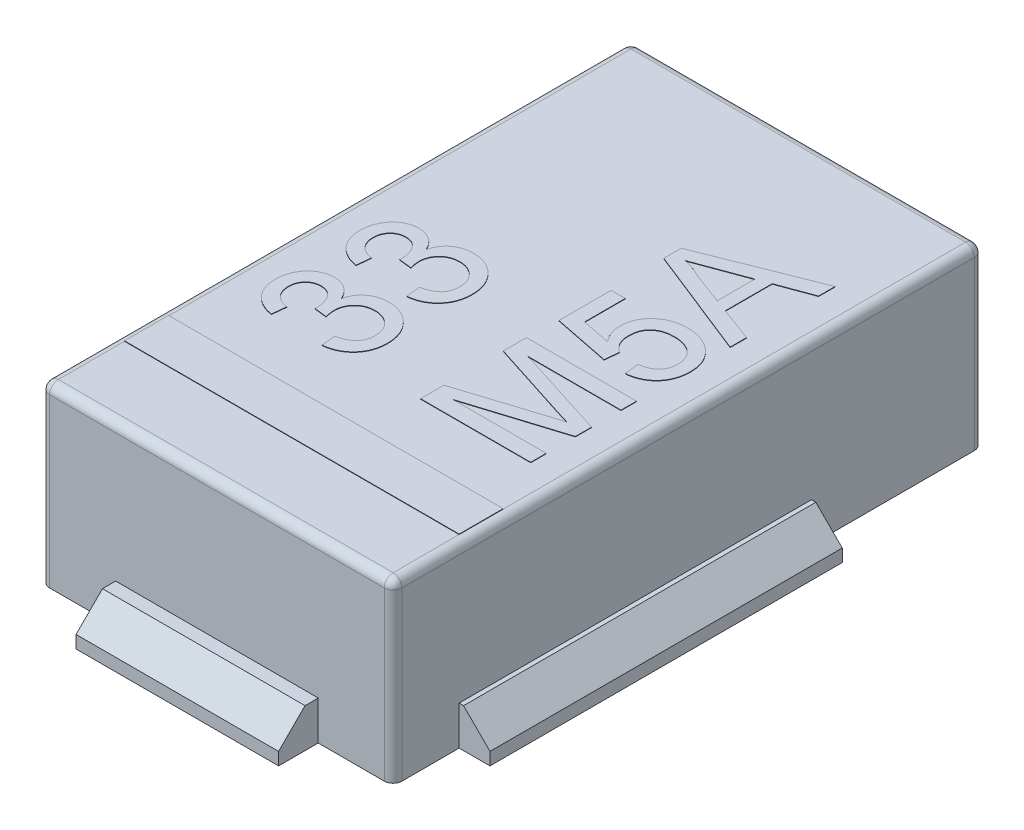
from build123d import *

# Parameters (mm, degrees)
SKETCH1_W           = 2.032
SKETCH1_H           = 3.4036
BOSS_EXTRUDE1_DEPTH = 1.016
SKETCH2_W           = 1.1684
SKETCH2_H           = 0.5334
SKETCH2_W_2         = 0.8128
BOSS_EXTRUDE2_DEPTH = 0.225
SKETCH3_W           = 2.032
SKETCH3_H           = 0.225
BOSS_EXTRUDE3_DEPTH = 0.1778
FILLET1_R           = 0.0508
CHAMFER1_SIZE       = 0.1524
SKETCH4_W           = 1.9304
SKETCH4_H           = 0.254
BOSS_EXTRUDE4_DEPTH = 0.00254


with BuildPart() as part:
    # Sketch1 → Boss-Extrude1 (new body)
    with BuildSketch(Plane(origin=(0, 0, 0), x_dir=(1, 0, 0), z_dir=(0, 1, 0))):
        Rectangle(SKETCH1_W, SKETCH1_H)
    extrude(amount=BOSS_EXTRUDE1_DEPTH)

    # Sketch2 → Boss-Extrude2 (add)
    with BuildSketch(Plane.XZ):
        with Locations((0, 1.6637)):
            Rectangle(SKETCH2_W, SKETCH2_H)
        with Locations((0, -1.6637)):
            Rectangle(SKETCH2_W_2, SKETCH2_H)
    extrude(amount=-BOSS_EXTRUDE2_DEPTH)

    # Sketch3 → Boss-Extrude3 (add)
    with BuildSketch(Plane(origin=(1.016, 0, 0), x_dir=(0, 0, -1), z_dir=(1, 0, 0))):
        with Locations((-0.3048, 0.1125)):
            Rectangle(SKETCH3_W, SKETCH3_H)
    extrude(amount=BOSS_EXTRUDE3_DEPTH)

    # Fillet1
    fillet1_edges = [part.edges().sort_by_distance(p)[0] for p in [
        (1.016, 1.016, 0),
        (0, 1.016, -1.7018),
        (-1.016, 1.016, 0),
        (0, 1.016, 1.7018),
        (-1.016, 0.508, -1.7018),
        (1.016, 0.508, -1.7018),
        (1.016, 0.508, 1.7018),
        (-1.016, 0.508, 1.7018),
    ]]
    fillet(fillet1_edges, radius=FILLET1_R)

    # Chamfer1
    chamfer1_edges = [part.edges().sort_by_distance(p)[0] for p in [
        (0, 0.225, 1.9304),
        (0, 0.225, -1.9304),
        (1.1938, 0.225, 0.3048),
    ]]
    chamfer(chamfer1_edges, length=CHAMFER1_SIZE)

    # Sketch4 → Boss-Extrude4 (add)
    # profile 1 of 6: a face of its own
    with BuildSketch(Plane(origin=(0, 1.016, 0), x_dir=(1, 0, 0), z_dir=(0, 1, 0))):
        with Locations((0, -1.143)):
            Rectangle(SKETCH4_W, SKETCH4_H)
    # profile 2 of 6: a face of its own
    with BuildSketch(Plane(origin=(0, 1.016, 0), x_dir=(1, 0, 0), z_dir=(0, 1, 0))):
        with BuildLine():
            Line((-0.374161538, -0.721294872), (-0.382302564, -0.639884615))
            add(Edge.make_bspline(
                [(-0.382302564, -0.639884615), (-0.377411282, -0.638798609), (-0.367947013, -0.636697267), (-0.354383105, -0.63266631), (-0.341775744, -0.628352426), (-0.330392924, -0.62316986), (-0.31990753, -0.617896561), (-0.310613038, -0.61187602), (-0.302287261, -0.605386996), (-0.294970686, -0.598371019), (-0.288676676, -0.590734474), (-0.283148159, -0.582591797), (-0.27860165, -0.573717856), (-0.274712564, -0.564349862), (-0.272017544, -0.554271368), (-0.269781413, -0.543716327), (-0.26851125, -0.532470982), (-0.268390216, -0.524768434), (-0.268328205, -0.520822115)],
                knots=[0, 0, 0, 0, 1.320955491, 2.555950884, 3.730166412, 4.831514729, 5.851821917, 6.822704906, 7.746598525, 8.632348365, 9.489981072, 10.352194446, 11.222491698, 12.115412579, 13.021677975, 13.96909362, 14.959486747, 16, 16, 16, 16], degree=3))
            add(Edge.make_bspline(
                [(-0.268328205, -0.520822115), (-0.268395571, -0.516193192), (-0.268527137, -0.507152898), (-0.270442215, -0.493971256), (-0.273163488, -0.481471968), (-0.277082368, -0.469654629), (-0.28240648, -0.458683464), (-0.288642986, -0.448285531), (-0.296045418, -0.438582731), (-0.30457253, -0.429706416), (-0.313958933, -0.421770724), (-0.323871736, -0.414702243), (-0.334397499, -0.408857715), (-0.345387448, -0.403931617), (-0.357019311, -0.400295522), (-0.369148009, -0.397633605), (-0.381828402, -0.395894028), (-0.390480165, -0.395735006), (-0.394895713, -0.395653846)],
                knots=[0, 0, 0, 0, 1.111305623, 2.170381722, 3.19371552, 4.182850272, 5.153552327, 6.118085682, 7.092150549, 8.07939443, 9.069578106, 10.041989709, 10.999935456, 11.957881203, 12.930986452, 13.922270303, 14.939601495, 16, 16, 16, 16], degree=3))
            add(Edge.make_bspline(
                [(-0.394895713, -0.395653846), (-0.399097782, -0.395749232), (-0.407318795, -0.395935848), (-0.419385478, -0.397469979), (-0.430840014, -0.400147004), (-0.441748696, -0.403858), (-0.452095509, -0.408599891), (-0.461966011, -0.414299505), (-0.471143889, -0.4212706), (-0.479727723, -0.429117182), (-0.487635896, -0.437675513), (-0.494362816, -0.447041293), (-0.500168367, -0.456897613), (-0.504856122, -0.467361938), (-0.50857682, -0.47839082), (-0.511250958, -0.489973746), (-0.512785755, -0.502166402), (-0.512972403, -0.510471888), (-0.513067788, -0.514716346)],
                knots=[0, 0, 0, 0, 1.072815875, 2.098878726, 3.09954706, 4.07199174, 5.036203424, 6.001873089, 6.97636515, 7.972747947, 8.969130744, 9.945905975, 10.911575641, 11.885646534, 12.868345115, 13.879560892, 14.916365174, 16, 16, 16, 16], degree=3))
            add(Edge.make_bspline(
                [(-0.513067788, -0.514716346), (-0.512968784, -0.518453333), (-0.512758673, -0.526384091), (-0.510903475, -0.538901482), (-0.508305762, -0.552766612), (-0.505756492, -0.562347812), (-0.504417949, -0.567378606)],
                knots=[0, 0, 0, 0, 0.837610211, 1.777604146, 2.833088267, 4, 4, 4, 4], degree=3))
            Line((-0.504417949, -0.567378606), (-0.577687179, -0.558983173))
            add(Edge.make_bspline(
                [(-0.577687179, -0.558983173), (-0.577446477, -0.556780408), (-0.57702124, -0.55288888), (-0.576864691, -0.548977728), (-0.576796755, -0.547280449)],
                knots=[0, 0, 0, 0, 1.132082448, 2, 2, 2, 2], degree=3))
            add(Edge.make_bspline(
                [(-0.576796755, -0.547280449), (-0.577086341, -0.539794878), (-0.577654419, -0.525110541), (-0.582263731, -0.503663898), (-0.589807279, -0.483438332), (-0.598496624, -0.467707267), (-0.606764373, -0.456156748), (-0.614048987, -0.448678413), (-0.622030339, -0.442250824), (-0.630974284, -0.437186883), (-0.640565797, -0.432980184), (-0.651102252, -0.430331432), (-0.662334552, -0.428410699), (-0.670112693, -0.428283352), (-0.674107452, -0.428217949)],
                knots=[0, 0, 0, 0, 1.557969126, 3.056245712, 4.545750906, 6.04003976, 6.785459704, 7.497485506, 8.20781137, 8.91218283, 9.632323302, 10.382125039, 11.169078961, 12, 12, 12, 12], degree=3))
            add(Edge.make_bspline(
                [(-0.674107452, -0.428217949), (-0.677334332, -0.428277975), (-0.683645199, -0.428395371), (-0.692896543, -0.429707919), (-0.701666498, -0.431868912), (-0.71006597, -0.434835932), (-0.718080588, -0.438606921), (-0.725598612, -0.443408903), (-0.732792854, -0.448851228), (-0.739340792, -0.455226402), (-0.745333049, -0.462191293), (-0.750512047, -0.469725919), (-0.755111183, -0.477657447), (-0.758520025, -0.486241685), (-0.761627634, -0.495138468), (-0.763360803, -0.504662911), (-0.764775499, -0.514589449), (-0.764878284, -0.521409899), (-0.764930769, -0.524892628)],
                knots=[0, 0, 0, 0, 1.041182713, 2.036259675, 3.009053839, 3.952907916, 4.908109765, 5.861446079, 6.82795941, 7.815474888, 8.805832688, 9.789355115, 10.763977569, 11.758018238, 12.766655917, 13.800251841, 14.87674186, 16, 16, 16, 16], degree=3))
            add(Edge.make_bspline(
                [(-0.764930769, -0.524892628), (-0.764665111, -0.531705849), (-0.764152084, -0.544863187), (-0.759405527, -0.563700755), (-0.751724979, -0.580770994), (-0.742717841, -0.593408975), (-0.734106507, -0.602383053), (-0.726807408, -0.608512824), (-0.718747075, -0.613995556), (-0.70992838, -0.61884679), (-0.700315858, -0.623000983), (-0.690028593, -0.626745872), (-0.678901886, -0.629644764), (-0.671192175, -0.631032122), (-0.667238462, -0.63174359)],
                knots=[0, 0, 0, 0, 1.533565899, 2.961543033, 4.347411787, 5.731829577, 6.434842101, 7.147085226, 7.87612511, 8.629021686, 9.412189982, 10.234506416, 11.094615066, 12, 12, 12, 12], degree=3))
            Line((-0.667238462, -0.63174359), (-0.675379487, -0.713153846))
            add(Edge.make_bspline(
                [(-0.675379487, -0.713153846), (-0.681674217, -0.711880347), (-0.694021824, -0.709382277), (-0.711855135, -0.704292897), (-0.728595534, -0.69808646), (-0.744166273, -0.690634589), (-0.758753694, -0.682289335), (-0.77218477, -0.672662479), (-0.784539348, -0.661979723), (-0.795779747, -0.650222092), (-0.805818681, -0.637549201), (-0.814478578, -0.624024882), (-0.821819089, -0.609760123), (-0.82773684, -0.594741569), (-0.832548868, -0.57898111), (-0.835736848, -0.56243391), (-0.837893357, -0.545174866), (-0.838096528, -0.53342216), (-0.8382, -0.527436699)],
                knots=[0, 0, 0, 0, 1.136581168, 2.229493434, 3.279335563, 4.293305329, 5.282068175, 6.250623624, 7.213783178, 8.169396253, 9.125981663, 10.071280146, 11.007896369, 11.961295906, 12.925420184, 13.920544621, 14.940967302, 16, 16, 16, 16], degree=3))
            add(Edge.make_bspline(
                [(-0.8382, -0.527436699), (-0.837934849, -0.51915041), (-0.837413477, -0.502856887), (-0.833169383, -0.478954454), (-0.826477796, -0.456025396), (-0.816919602, -0.434343939), (-0.805095894, -0.414355052), (-0.7911497, -0.396549687), (-0.775093797, -0.381403369), (-0.757230701, -0.368907107), (-0.738053317, -0.359231133), (-0.718200578, -0.351939229), (-0.697656651, -0.347617688), (-0.683752187, -0.34707824), (-0.676778726, -0.346807692)],
                knots=[0, 0, 0, 0, 1.104495358, 2.171794967, 3.227495605, 4.283438557, 5.323113896, 6.31758976, 7.28968941, 8.256097513, 9.214630814, 10.146622999, 11.070481679, 12, 12, 12, 12], degree=3))
            add(Edge.make_bspline(
                [(-0.676778726, -0.346807692), (-0.67018644, -0.347081405), (-0.657170286, -0.347621836), (-0.638138364, -0.351782523), (-0.620107758, -0.358813255), (-0.603015206, -0.368316165), (-0.58723035, -0.380639108), (-0.573164604, -0.395748237), (-0.560683381, -0.413401844), (-0.554187042, -0.42663173), (-0.550847236, -0.433433293)],
                knots=[0, 0, 0, 0, 0.975609618, 1.926294443, 2.868398979, 3.832526731, 4.812148358, 5.820404151, 6.879456693, 8, 8, 8, 8], degree=3))
            add(Edge.make_bspline(
                [(-0.550847236, -0.433433293), (-0.549700597, -0.428871037), (-0.547454667, -0.419934908), (-0.542722211, -0.4071552), (-0.537493886, -0.394974737), (-0.531039388, -0.383693532), (-0.523949287, -0.372992477), (-0.515738204, -0.363252458), (-0.506821452, -0.35412278), (-0.49696788, -0.345902307), (-0.486491522, -0.338305159), (-0.475082952, -0.332039825), (-0.46319644, -0.32652095), (-0.450687324, -0.321859243), (-0.437451577, -0.318501803), (-0.423584584, -0.316103219), (-0.409136516, -0.3145198), (-0.399267239, -0.314336562), (-0.394259696, -0.31424359)],
                knots=[0, 0, 0, 0, 1.053053532, 2.062624492, 3.049279, 4.018960713, 4.970039945, 5.921119178, 6.868205456, 7.825384292, 8.792690302, 9.762372016, 10.735629589, 11.727346586, 12.747983982, 13.789622546, 14.878482913, 16, 16, 16, 16], degree=3))
            add(Edge.make_bspline(
                [(-0.394259696, -0.31424359), (-0.387423179, -0.314398497), (-0.373987231, -0.314702939), (-0.354249919, -0.317590307), (-0.335337369, -0.322306042), (-0.317192693, -0.328842065), (-0.299747142, -0.337072188), (-0.283312089, -0.347532302), (-0.267600489, -0.359667912), (-0.252818271, -0.373459111), (-0.239261347, -0.388615154), (-0.227343386, -0.404940188), (-0.217382885, -0.422372158), (-0.209229621, -0.440750779), (-0.202834633, -0.460092446), (-0.198247776, -0.48040462), (-0.195552689, -0.501753385), (-0.195225712, -0.516319843), (-0.195058974, -0.523747796)],
                knots=[0, 0, 0, 0, 1.016160013, 1.997080508, 2.959030091, 3.910423094, 4.860896231, 5.821377361, 6.801365134, 7.809669134, 8.823459125, 9.82111916, 10.8097111, 11.803357757, 12.806343984, 13.834310821, 14.89563831, 16, 16, 16, 16], degree=3))
            add(Edge.make_bspline(
                [(-0.195058974, -0.523747796), (-0.195203574, -0.530411043), (-0.19548813, -0.543523553), (-0.197791728, -0.562775627), (-0.201716322, -0.581129128), (-0.207269315, -0.598611874), (-0.214206075, -0.615260874), (-0.222783117, -0.631057924), (-0.23307553, -0.645852122), (-0.244707623, -0.659808639), (-0.257618122, -0.672525551), (-0.271421734, -0.684070712), (-0.286418835, -0.693733251), (-0.302091721, -0.70242747), (-0.318797689, -0.709364345), (-0.336424675, -0.714875704), (-0.354945227, -0.718955904), (-0.367700264, -0.72050842), (-0.374161538, -0.721294872)],
                knots=[0, 0, 0, 0, 1.084591917, 2.134353484, 3.151186507, 4.135829161, 5.116616683, 6.083506893, 7.056244441, 8.046172411, 9.037086737, 10.003163388, 10.970053598, 11.936943808, 12.917731331, 13.908958199, 14.94074836, 16, 16, 16, 16], degree=3))
        make_face()
    # profile 3 of 6: a face of its own
    with BuildSketch(Plane(origin=(0, 1.016, 0), x_dir=(1, 0, 0), z_dir=(0, 1, 0))):
        with BuildLine():
            Line((-0.374161538, -0.232833333), (-0.382302564, -0.151423077))
            add(Edge.make_bspline(
                [(-0.382302564, -0.151423077), (-0.377411282, -0.15033707), (-0.367947013, -0.148235728), (-0.354383105, -0.144204771), (-0.341775744, -0.139890887), (-0.330392924, -0.134708321), (-0.31990753, -0.129435022), (-0.310613038, -0.123414482), (-0.302287261, -0.116925457), (-0.294970686, -0.10990948), (-0.288676676, -0.102272936), (-0.283148159, -0.094130258), (-0.27860165, -0.085256318), (-0.274712564, -0.075888323), (-0.272017544, -0.065809829), (-0.269781413, -0.055254788), (-0.26851125, -0.044009443), (-0.268390216, -0.036306895), (-0.268328205, -0.032360577)],
                knots=[0, 0, 0, 0, 1.320955491, 2.555950884, 3.730166412, 4.831514729, 5.851821917, 6.822704906, 7.746598525, 8.632348365, 9.489981072, 10.352194446, 11.222491698, 12.115412579, 13.021677975, 13.96909362, 14.959486747, 16, 16, 16, 16], degree=3))
            add(Edge.make_bspline(
                [(-0.268328205, -0.032360577), (-0.268395571, -0.027731654), (-0.268527137, -0.01869136), (-0.270442215, -0.005509718), (-0.273163488, 0.00698957), (-0.277082368, 0.018806909), (-0.28240648, 0.029778075), (-0.288642986, 0.040176007), (-0.296045418, 0.049878808), (-0.30457253, 0.058755123), (-0.313958933, 0.066690814), (-0.323871736, 0.073759296), (-0.334397499, 0.079603823), (-0.345387448, 0.084529922), (-0.357019311, 0.088166016), (-0.369148009, 0.090827934), (-0.381828402, 0.09256751), (-0.390480165, 0.092726533), (-0.394895713, 0.092807692)],
                knots=[0, 0, 0, 0, 1.111305623, 2.170381722, 3.19371552, 4.182850272, 5.153552327, 6.118085682, 7.092150549, 8.07939443, 9.069578106, 10.041989709, 10.999935456, 11.957881203, 12.930986452, 13.922270303, 14.939601495, 16, 16, 16, 16], degree=3))
            add(Edge.make_bspline(
                [(-0.394895713, 0.092807692), (-0.399097782, 0.092712306), (-0.407318795, 0.09252569), (-0.419385478, 0.09099156), (-0.430840014, 0.088314535), (-0.441748696, 0.084603539), (-0.452095509, 0.079861647), (-0.461966011, 0.074162034), (-0.471143889, 0.067190939), (-0.479727723, 0.059344357), (-0.487635896, 0.050786025), (-0.494362816, 0.041420246), (-0.500168367, 0.031563926), (-0.504856122, 0.0210996), (-0.50857682, 0.010070718), (-0.511250958, -0.001512207), (-0.512785755, -0.013704864), (-0.512972403, -0.02201035), (-0.513067788, -0.026254808)],
                knots=[0, 0, 0, 0, 1.072815875, 2.098878726, 3.09954706, 4.07199174, 5.036203424, 6.001873089, 6.97636515, 7.972747947, 8.969130744, 9.945905975, 10.911575641, 11.885646534, 12.868345115, 13.879560892, 14.916365174, 16, 16, 16, 16], degree=3))
            add(Edge.make_bspline(
                [(-0.513067788, -0.026254808), (-0.512968784, -0.029991795), (-0.512758673, -0.037922553), (-0.510903475, -0.050439943), (-0.508305762, -0.064305073), (-0.505756492, -0.073886274), (-0.504417949, -0.078917067)],
                knots=[0, 0, 0, 0, 0.837610211, 1.777604146, 2.833088267, 4, 4, 4, 4], degree=3))
            Line((-0.504417949, -0.078917067), (-0.577687179, -0.070521635))
            add(Edge.make_bspline(
                [(-0.577687179, -0.070521635), (-0.577446477, -0.068318869), (-0.57702124, -0.064427342), (-0.576864691, -0.060516189), (-0.576796755, -0.05881891)],
                knots=[0, 0, 0, 0, 1.132082448, 2, 2, 2, 2], degree=3))
            add(Edge.make_bspline(
                [(-0.576796755, -0.05881891), (-0.577086341, -0.051333339), (-0.577654419, -0.036649002), (-0.582263731, -0.01520236), (-0.589807279, 0.005023207), (-0.598496624, 0.020754272), (-0.606764373, 0.03230479), (-0.614048987, 0.039783125), (-0.622030339, 0.046210715), (-0.630974284, 0.051274655), (-0.640565797, 0.055481354), (-0.651102252, 0.058130107), (-0.662334552, 0.06005084), (-0.670112693, 0.060178186), (-0.674107452, 0.06024359)],
                knots=[0, 0, 0, 0, 1.557969126, 3.056245712, 4.545750906, 6.04003976, 6.785459704, 7.497485506, 8.20781137, 8.91218283, 9.632323302, 10.382125039, 11.169078961, 12, 12, 12, 12], degree=3))
            add(Edge.make_bspline(
                [(-0.674107452, 0.06024359), (-0.677334332, 0.060183563), (-0.683645199, 0.060066168), (-0.692896543, 0.058753619), (-0.701666498, 0.056592626), (-0.71006597, 0.053625607), (-0.718080588, 0.049854617), (-0.725598612, 0.045052635), (-0.732792854, 0.03961031), (-0.739340792, 0.033235136), (-0.745333049, 0.026270245), (-0.750512047, 0.01873562), (-0.755111183, 0.010804092), (-0.758520025, 0.002219854), (-0.761627634, -0.006676929), (-0.763360803, -0.016201372), (-0.764775499, -0.02612791), (-0.764878284, -0.032948361), (-0.764930769, -0.03643109)],
                knots=[0, 0, 0, 0, 1.041182713, 2.036259675, 3.009053839, 3.952907916, 4.908109765, 5.861446079, 6.82795941, 7.815474888, 8.805832688, 9.789355115, 10.763977569, 11.758018238, 12.766655917, 13.800251841, 14.87674186, 16, 16, 16, 16], degree=3))
            add(Edge.make_bspline(
                [(-0.764930769, -0.03643109), (-0.764665111, -0.04324431), (-0.764152084, -0.056401648), (-0.759405527, -0.075239217), (-0.751724979, -0.092309455), (-0.742717841, -0.104947437), (-0.734106507, -0.113921515), (-0.726807408, -0.120051285), (-0.718747075, -0.125534018), (-0.70992838, -0.130385251), (-0.700315858, -0.134539444), (-0.690028593, -0.138284334), (-0.678901886, -0.141183226), (-0.671192175, -0.142570583), (-0.667238462, -0.143282051)],
                knots=[0, 0, 0, 0, 1.533565899, 2.961543033, 4.347411787, 5.731829577, 6.434842101, 7.147085226, 7.87612511, 8.629021686, 9.412189982, 10.234506416, 11.094615066, 12, 12, 12, 12], degree=3))
            Line((-0.667238462, -0.143282051), (-0.675379487, -0.224692308))
            add(Edge.make_bspline(
                [(-0.675379487, -0.224692308), (-0.681674217, -0.223418808), (-0.694021824, -0.220920739), (-0.711855135, -0.215831358), (-0.728595534, -0.209624921), (-0.744166273, -0.202173051), (-0.758753694, -0.193827797), (-0.77218477, -0.184200941), (-0.784539348, -0.173518185), (-0.795779747, -0.161760553), (-0.805818681, -0.149087663), (-0.814478578, -0.135563344), (-0.821819089, -0.121298585), (-0.82773684, -0.10628003), (-0.832548868, -0.090519572), (-0.835736848, -0.073972371), (-0.837893357, -0.056713327), (-0.838096528, -0.044960621), (-0.8382, -0.03897516)],
                knots=[0, 0, 0, 0, 1.136581168, 2.229493434, 3.279335563, 4.293305329, 5.282068175, 6.250623624, 7.213783178, 8.169396253, 9.125981663, 10.071280146, 11.007896369, 11.961295906, 12.925420184, 13.920544621, 14.940967302, 16, 16, 16, 16], degree=3))
            add(Edge.make_bspline(
                [(-0.8382, -0.03897516), (-0.837934849, -0.030688872), (-0.837413477, -0.014395349), (-0.833169383, 0.009507085), (-0.826477796, 0.032436142), (-0.816919602, 0.0541176), (-0.805095894, 0.074106486), (-0.7911497, 0.091911852), (-0.775093797, 0.10705817), (-0.757230701, 0.119554432), (-0.738053317, 0.129230406), (-0.718200578, 0.136522309), (-0.697656651, 0.14084385), (-0.683752187, 0.141383298), (-0.676778726, 0.141653846)],
                knots=[0, 0, 0, 0, 1.104495358, 2.171794967, 3.227495605, 4.283438557, 5.323113896, 6.31758976, 7.28968941, 8.256097513, 9.214630814, 10.146622999, 11.070481679, 12, 12, 12, 12], degree=3))
            add(Edge.make_bspline(
                [(-0.676778726, 0.141653846), (-0.67018644, 0.141380134), (-0.657170286, 0.140839702), (-0.638138364, 0.136679016), (-0.620107758, 0.129648283), (-0.603015206, 0.120145373), (-0.58723035, 0.10782243), (-0.573164604, 0.092713302), (-0.560683381, 0.075059694), (-0.554187042, 0.061829809), (-0.550847236, 0.055028245)],
                knots=[0, 0, 0, 0, 0.975609618, 1.926294443, 2.868398979, 3.832526731, 4.812148358, 5.820404151, 6.879456693, 8, 8, 8, 8], degree=3))
            add(Edge.make_bspline(
                [(-0.550847236, 0.055028245), (-0.549700597, 0.059590502), (-0.547454667, 0.068526631), (-0.542722211, 0.081306339), (-0.537493886, 0.093486801), (-0.531039388, 0.104768006), (-0.523949287, 0.115469061), (-0.515738204, 0.12520908), (-0.506821452, 0.134338759), (-0.49696788, 0.142559231), (-0.486491522, 0.15015638), (-0.475082952, 0.156421713), (-0.46319644, 0.161940588), (-0.450687324, 0.166602295), (-0.437451577, 0.169959736), (-0.423584584, 0.172358319), (-0.409136516, 0.173941738), (-0.399267239, 0.174124976), (-0.394259696, 0.174217949)],
                knots=[0, 0, 0, 0, 1.053053532, 2.062624492, 3.049279, 4.018960713, 4.970039945, 5.921119178, 6.868205456, 7.825384292, 8.792690302, 9.762372016, 10.735629589, 11.727346586, 12.747983982, 13.789622546, 14.878482913, 16, 16, 16, 16], degree=3))
            add(Edge.make_bspline(
                [(-0.394259696, 0.174217949), (-0.387423179, 0.174063042), (-0.373987231, 0.173758599), (-0.354249919, 0.170871232), (-0.335337369, 0.166155496), (-0.317192693, 0.159619473), (-0.299747142, 0.15138935), (-0.283312089, 0.140929237), (-0.267600489, 0.128793627), (-0.252818271, 0.115002427), (-0.239261347, 0.099846385), (-0.227343386, 0.083521351), (-0.217382885, 0.066089381), (-0.209229621, 0.047710759), (-0.202834633, 0.028369093), (-0.198247776, 0.008056918), (-0.195552689, -0.013291846), (-0.195225712, -0.027858305), (-0.195058974, -0.035286258)],
                knots=[0, 0, 0, 0, 1.016160013, 1.997080508, 2.959030091, 3.910423094, 4.860896231, 5.821377361, 6.801365134, 7.809669134, 8.823459125, 9.82111916, 10.8097111, 11.803357757, 12.806343984, 13.834310821, 14.89563831, 16, 16, 16, 16], degree=3))
            add(Edge.make_bspline(
                [(-0.195058974, -0.035286258), (-0.195203574, -0.041949504), (-0.19548813, -0.055062014), (-0.197791728, -0.074314089), (-0.201716322, -0.09266759), (-0.207269315, -0.110150335), (-0.214206075, -0.126799336), (-0.222783117, -0.142596386), (-0.23307553, -0.157390583), (-0.244707623, -0.171347101), (-0.257618122, -0.184064012), (-0.271421734, -0.195609173), (-0.286418835, -0.205271713), (-0.302091721, -0.213965931), (-0.318797689, -0.220902806), (-0.336424675, -0.226414166), (-0.354945227, -0.230494366), (-0.367700264, -0.232046881), (-0.374161538, -0.232833333)],
                knots=[0, 0, 0, 0, 1.084591917, 2.134353484, 3.151186507, 4.135829161, 5.116616683, 6.083506893, 7.056244441, 8.046172411, 9.037086737, 10.003163388, 10.970053598, 11.936943808, 12.917731331, 13.908958199, 14.94074836, 16, 16, 16, 16], degree=3))
        make_face()
    # profile 4 of 6: a face of its own
    with BuildSketch(Plane(origin=(0, 1.016, 0), x_dir=(1, 0, 0), z_dir=(0, 1, 0))):
        with BuildLine():
            Line((0.8128, -0.705012821), (0.1778, -0.705012821))
            Line((0.1778, -0.705012821), (0.1778, -0.570304287))
            Line((0.1778, -0.570304287), (0.62339395, -0.428345152))
            add(Edge.make_bspline(
                [(0.62339395, -0.428345152), (0.628441753, -0.426782886), (0.63820391, -0.423761554), (0.652301363, -0.419281277), (0.665401786, -0.415204976), (0.677546877, -0.411533625), (0.688676338, -0.408068923), (0.698881493, -0.405069038), (0.708048941, -0.40220105), (0.713875154, -0.400520281), (0.716634135, -0.399724359)],
                knots=[0, 0, 0, 0, 1.300204174, 2.514519184, 3.639827924, 4.676153899, 5.636536826, 6.507959918, 7.293450077, 8, 8, 8, 8], degree=3))
            add(Edge.make_bspline(
                [(0.716634135, -0.399724359), (0.713622466, -0.398837887), (0.707213441, -0.396951417), (0.697136349, -0.393893149), (0.685984913, -0.390639064), (0.673950808, -0.386744922), (0.660845256, -0.38268574), (0.646679141, -0.3784251), (0.631593895, -0.373510535), (0.621150147, -0.370244561), (0.615761739, -0.368559495)],
                knots=[0, 0, 0, 0, 0.713638162, 1.518667645, 2.393860736, 3.354087503, 4.393659122, 5.512594909, 6.716633584, 8, 8, 8, 8], degree=3))
            Line((0.615761739, -0.368559495), (0.1778, -0.227999599))
            Line((0.1778, -0.227999599), (0.1778, -0.094435897))
            Line((0.1778, -0.094435897), (0.8128, -0.094435897))
            Line((0.8128, -0.094435897), (0.8128, -0.183987179))
            Line((0.8128, -0.183987179), (0.275492308, -0.183987179))
            Line((0.275492308, -0.183987179), (0.8128, -0.353422276))
            Line((0.8128, -0.353422276), (0.8128, -0.447044071))
            Line((0.8128, -0.447044071), (0.275492308, -0.615461538))
            Line((0.275492308, -0.615461538), (0.8128, -0.615461538))
            Line((0.8128, -0.615461538), (0.8128, -0.705012821))
        make_face()
    # profile 5 of 6: a face of its own
    with BuildSketch(Plane(origin=(0, 1.016, 0), x_dir=(1, 0, 0), z_dir=(0, 1, 0))):
        with BuildLine():
            Line((0.641838462, 0.011397436), (0.633697436, 0.092807692))
            add(Edge.make_bspline(
                [(0.633697436, 0.092807692), (0.638284457, 0.093613782), (0.647206927, 0.095181751), (0.660122466, 0.098169689), (0.672121363, 0.102050171), (0.683307535, 0.106410319), (0.693562702, 0.111593091), (0.703048788, 0.117208667), (0.711429067, 0.123831092), (0.719141835, 0.130793682), (0.725938147, 0.138435656), (0.731667673, 0.146830755), (0.736666337, 0.155744749), (0.740759022, 0.165286207), (0.743754651, 0.175469752), (0.74612368, 0.186165776), (0.747317422, 0.197512009), (0.74755216, 0.205253466), (0.747671795, 0.209198918)],
                knots=[0, 0, 0, 0, 1.237781394, 2.407677316, 3.51963579, 4.58689595, 5.594855907, 6.570874, 7.510833816, 8.428091223, 9.330271693, 10.221190844, 11.124215526, 12.043132878, 12.973586933, 13.941700858, 14.950982896, 16, 16, 16, 16], degree=3))
            add(Edge.make_bspline(
                [(0.747671795, 0.209198918), (0.747553502, 0.214038585), (0.747322174, 0.223502763), (0.745406567, 0.237280081), (0.742153728, 0.250247158), (0.73793152, 0.262527071), (0.732150813, 0.273923624), (0.72501403, 0.284403047), (0.716918217, 0.294335167), (0.707290919, 0.303142587), (0.69680372, 0.31115725), (0.685358215, 0.318075179), (0.673113018, 0.323898919), (0.66007103, 0.328801921), (0.646157594, 0.332422417), (0.63144677, 0.335085588), (0.615929175, 0.336795237), (0.605293207, 0.336956237), (0.599861298, 0.337038462)],
                knots=[0, 0, 0, 0, 1.052750423, 2.05869932, 3.018624241, 3.958205853, 4.878289862, 5.789216265, 6.712947111, 7.659433357, 8.620775926, 9.5811884, 10.56329027, 11.567503128, 12.60809625, 13.686605721, 14.818523251, 16, 16, 16, 16], degree=3))
            add(Edge.make_bspline(
                [(0.599861298, 0.337038462), (0.594684759, 0.336945006), (0.584604837, 0.336763028), (0.569926795, 0.335230469), (0.556124993, 0.332644863), (0.543047312, 0.32929933), (0.530898107, 0.324687936), (0.519501225, 0.319218562), (0.509098543, 0.31251835), (0.499366158, 0.305063921), (0.490641467, 0.296550023), (0.48327457, 0.286861633), (0.476827048, 0.276378821), (0.47159851, 0.264890454), (0.467713902, 0.252389765), (0.464725046, 0.239000978), (0.46315303, 0.224585164), (0.46287744, 0.214671927), (0.462735897, 0.209580529)],
                knots=[0, 0, 0, 0, 1.165854935, 2.270189951, 3.319242023, 4.32700288, 5.306253956, 6.24172124, 7.169108591, 8.088047231, 8.999810445, 9.905349262, 10.822648491, 11.767237767, 12.739852311, 13.766490849, 14.852878837, 16, 16, 16, 16], degree=3))
            add(Edge.make_bspline(
                [(0.462735897, 0.209580529), (0.462922116, 0.203250111), (0.46327924, 0.191109802), (0.466253422, 0.173657603), (0.471121694, 0.157816757), (0.4781376, 0.14361625), (0.486748426, 0.130971695), (0.496605113, 0.119666509), (0.507442371, 0.109382893), (0.515613516, 0.103771093), (0.519723077, 0.100948718)],
                knots=[0, 0, 0, 0, 1.182633468, 2.268023356, 3.298275715, 4.269491976, 5.216938987, 6.149685646, 7.069410919, 8, 8, 8, 8], degree=3))
            Line((0.519723077, 0.100948718), (0.511582051, 0.019538462))
            Line((0.511582051, 0.019538462), (0.185941026, 0.084666667))
            Line((0.185941026, 0.084666667), (0.185941026, 0.385884615))
            Line((0.185941026, 0.385884615), (0.267351282, 0.385884615))
            Line((0.267351282, 0.385884615), (0.267351282, 0.151194111))
            Line((0.267351282, 0.151194111), (0.431825441, 0.118884415))
            add(Edge.make_bspline(
                [(0.431825441, 0.118884415), (0.428454581, 0.123376415), (0.421834746, 0.132197992), (0.413166944, 0.145958072), (0.405860565, 0.159914906), (0.399877255, 0.173987248), (0.395216268, 0.188286882), (0.391978028, 0.202727516), (0.389789436, 0.217358318), (0.389574563, 0.227169134), (0.389466667, 0.232095553)],
                knots=[0, 0, 0, 0, 1.093835215, 2.148119334, 3.164235237, 4.159999629, 5.123971815, 6.089888814, 7.040853737, 8, 8, 8, 8], degree=3))
            add(Edge.make_bspline(
                [(0.389466667, 0.232095553), (0.389634706, 0.238506917), (0.389965616, 0.251132449), (0.392682766, 0.269737219), (0.3972996, 0.28752414), (0.403503066, 0.304643907), (0.41177101, 0.320809014), (0.42157694, 0.336363368), (0.433398769, 0.350993054), (0.446780686, 0.364785211), (0.461655912, 0.377341464), (0.477608032, 0.388455622), (0.494779125, 0.397645115), (0.512803174, 0.405328411), (0.531974956, 0.411131344), (0.552031064, 0.415533747), (0.573219837, 0.417888051), (0.587644551, 0.418258904), (0.595027564, 0.418448718)],
                knots=[0, 0, 0, 0, 0.99184379, 1.95318097, 2.901668786, 3.831684196, 4.764819115, 5.705879134, 6.672196848, 7.669818607, 8.675456628, 9.680130933, 10.672473775, 11.683959944, 12.707147321, 13.767588937, 14.857383263, 16, 16, 16, 16], degree=3))
            add(Edge.make_bspline(
                [(0.595027564, 0.418448718), (0.602072165, 0.418304573), (0.615987261, 0.418019846), (0.636493728, 0.415686451), (0.656253322, 0.411842736), (0.675324559, 0.406697062), (0.693599129, 0.399744566), (0.711136059, 0.39131184), (0.728118342, 0.381584217), (0.738586939, 0.373783168), (0.743855689, 0.369856971)],
                knots=[0, 0, 0, 0, 1.059692978, 2.093196008, 3.100373587, 4.086253034, 5.061402885, 6.037282833, 7.012182238, 8, 8, 8, 8], degree=3))
            add(Edge.make_bspline(
                [(0.743855689, 0.369856971), (0.750004837, 0.364868248), (0.762100872, 0.355054895), (0.77782002, 0.338073784), (0.79111732, 0.319761302), (0.802180868, 0.300224662), (0.810660825, 0.279219527), (0.816518783, 0.256856595), (0.820394519, 0.233205026), (0.82075635, 0.216974181), (0.820941026, 0.208690104)],
                knots=[0, 0, 0, 0, 1.023063757, 2.01247625, 2.982117532, 3.944599247, 4.908953799, 5.902627458, 6.929519989, 8, 8, 8, 8], degree=3))
            add(Edge.make_bspline(
                [(0.820941026, 0.208690104), (0.82080204, 0.201856767), (0.820530157, 0.188489387), (0.818177978, 0.168914349), (0.814400176, 0.150306832), (0.809070408, 0.132596009), (0.80201426, 0.115942637), (0.793611089, 0.100109712), (0.78349584, 0.085387491), (0.772092783, 0.071618482), (0.759305569, 0.059190552), (0.745599063, 0.047911209), (0.730718389, 0.038219536), (0.714871423, 0.029925857), (0.69806033, 0.02302259), (0.680181454, 0.017738962), (0.661407171, 0.013554557), (0.648429759, 0.012124016), (0.641838462, 0.011397436)],
                knots=[0, 0, 0, 0, 1.108915132, 2.169260591, 3.195158146, 4.188014069, 5.165918008, 6.126692062, 7.092678666, 8.060306793, 9.02401023, 9.982884032, 10.937400194, 11.901029891, 12.882656982, 13.882099599, 14.924306988, 16, 16, 16, 16], degree=3))
        make_face()
    # profile 6 of 6: a face of its own
    with BuildSketch(Plane(origin=(0, 1.016, 0), x_dir=(1, 0, 0), z_dir=(0, 1, 0))):
        Polygon((0.8128, 0.445543069), (0.1778, 0.697660457), (0.1778, 0.798660056), (0.8128, 1.050777444), (0.8128, 0.95575641), (0.617415385, 0.883504808), (0.617415385, 0.612815705), (0.8128, 0.540564103), align=None)
        with BuildLine():
            Line((0.544146154, 0.639782853), (0.544146154, 0.85653766))
            Line((0.544146154, 0.85653766), (0.377255128, 0.79484395))
            add(Edge.make_bspline(
                [(0.377255128, 0.79484395), (0.370806686, 0.792478834), (0.358198765, 0.787854584), (0.33988052, 0.780958435), (0.322484762, 0.774658224), (0.306260923, 0.76848035), (0.290973333, 0.762903473), (0.276725255, 0.757763123), (0.263615719, 0.752679359), (0.255145608, 0.749628521), (0.251069231, 0.748160256)],
                knots=[0, 0, 0, 0, 1.225184869, 2.395467751, 3.491410812, 4.525364584, 5.492066482, 6.394148129, 7.227157926, 8, 8, 8, 8], degree=3))
            add(Edge.make_bspline(
                [(0.251069231, 0.748160256), (0.261119133, 0.745725498), (0.281299465, 0.740836472), (0.310846114, 0.730729491), (0.340056333, 0.718978041), (0.358871664, 0.709539179), (0.368350881, 0.704783854)],
                knots=[0, 0, 0, 0, 0.989154277, 1.986234384, 2.985459177, 4, 4, 4, 4], degree=3))
            Line((0.368350881, 0.704783854), (0.544146154, 0.639782853))
        make_face(mode=Mode.SUBTRACT)
    extrude(amount=BOSS_EXTRUDE4_DEPTH)


solid = part.part
